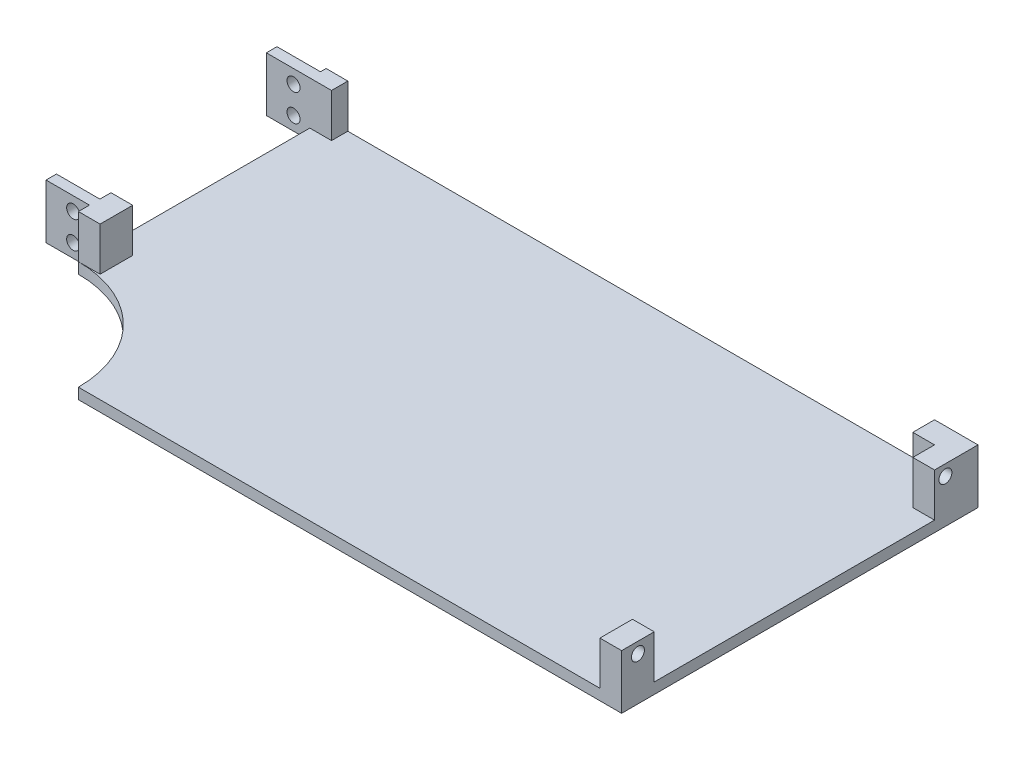
from build123d import *

# Parameters (mm, degrees)
BOSS_EXTRUDE1_DEPTH = 2.5
SKETCH2_W           = 5
SKETCH2_H           = 3.75
SKETCH2_H_2         = 7.5
BOSS_EXTRUDE2_DEPTH = 10
SKETCH4_W           = 2.4
SKETCH4_H           = 12.5
SKETCH4_W_2         = 2.45
BOSS_EXTRUDE3_DEPTH = 10
SKETCH5_R           = 1.5
CUT_EXTRUDE1_DEPTH  = 57
SKETCH6_W           = 5
SKETCH6_H           = 7.5
BOSS_EXTRUDE4_DEPTH = 10
SKETCH8_R           = 1.5
CUT_EXTRUDE2_DEPTH  = 5
SKETCH9_R           = 1.5
CUT_EXTRUDE3_DEPTH  = 5
SKETCH10_R          = 1.5
CUT_EXTRUDE4_DEPTH  = 5


with BuildPart() as part:
    # Sketch1 → Boss-Extrude1 (new body)
    with BuildSketch(Plane(origin=(0, 0, 0), x_dir=(1, 0, 0), z_dir=(0, 1, 0))):
        with BuildLine():
            Line((-75, 0), (75, 0))
            Line((75, 0), (75, -82))
            Line((75, -82), (-50, -82))
            ThreePointArc((-50, -82), (-57.32233047, -64.32233047), (-75, -57))
            Line((-75, -57), (-75, 0))
        make_face()
    extrude(amount=BOSS_EXTRUDE1_DEPTH)

    # Sketch2 → Boss-Extrude2 (add)
    with BuildSketch(Plane(origin=(0, 2.5, 0), x_dir=(1, 0, 0), z_dir=(0, 1, 0))):
        with Locations((-72.5, -1.875)):
            Rectangle(SKETCH2_W, SKETCH2_H)
        with Locations((-72.5, -53.25)):
            Rectangle(SKETCH2_W, SKETCH2_H_2)
    extrude(amount=BOSS_EXTRUDE2_DEPTH)

    # Sketch4 → Boss-Extrude3 (add)
    with BuildSketch(Plane.ZY.offset(75)):
        with Locations((53.25, 6.25)):
            Rectangle(SKETCH4_W, SKETCH4_H)
        with Locations((2.525, 6.25)):
            Rectangle(SKETCH4_W_2, SKETCH4_H)
    extrude(amount=BOSS_EXTRUDE3_DEPTH)

    # Sketch5 → Cut-Extrude1 (cut)
    with BuildSketch(Plane(origin=(0, 0, 1.3), x_dir=(-1, 0, 0), z_dir=(0, 0, -1))):
        with Locations((78.75, 9.375)):
            Circle(SKETCH5_R)
        with Locations((78.75, 3.125)):
            Circle(SKETCH5_R)
    extrude(amount=-CUT_EXTRUDE1_DEPTH, mode=Mode.SUBTRACT)

    # Sketch6 → Boss-Extrude4 (add)
    with BuildSketch(Plane(origin=(0, 2.5, 0), x_dir=(1, 0, 0), z_dir=(0, 1, 0))):
        Polygon((75, 0), (65, 0), (65, -5), (70, -5), (70, -10), (75, -10), align=None)
        with Locations((72.5, -78.25)):
            Rectangle(SKETCH6_W, SKETCH6_H)
    extrude(amount=BOSS_EXTRUDE4_DEPTH)

    # Sketch8 → Cut-Extrude2 (cut)
    with BuildSketch(Plane.ZY.offset(-70)):
        with Locations((7.5, 10)):
            Circle(SKETCH8_R)
    extrude(amount=-CUT_EXTRUDE2_DEPTH, mode=Mode.SUBTRACT)

    # Sketch9 → Cut-Extrude3 (cut)
    with BuildSketch(Plane.XY.offset(5)):
        with Locations((67.5, 5)):
            Circle(SKETCH9_R)
    extrude(amount=-CUT_EXTRUDE3_DEPTH, mode=Mode.SUBTRACT)

    # Sketch10 → Cut-Extrude4 (cut)
    with BuildSketch(Plane.ZY.offset(-70)):
        with Locations((78.25, 10)):
            Circle(SKETCH10_R)
    extrude(amount=-CUT_EXTRUDE4_DEPTH, mode=Mode.SUBTRACT)


solid = part.part
